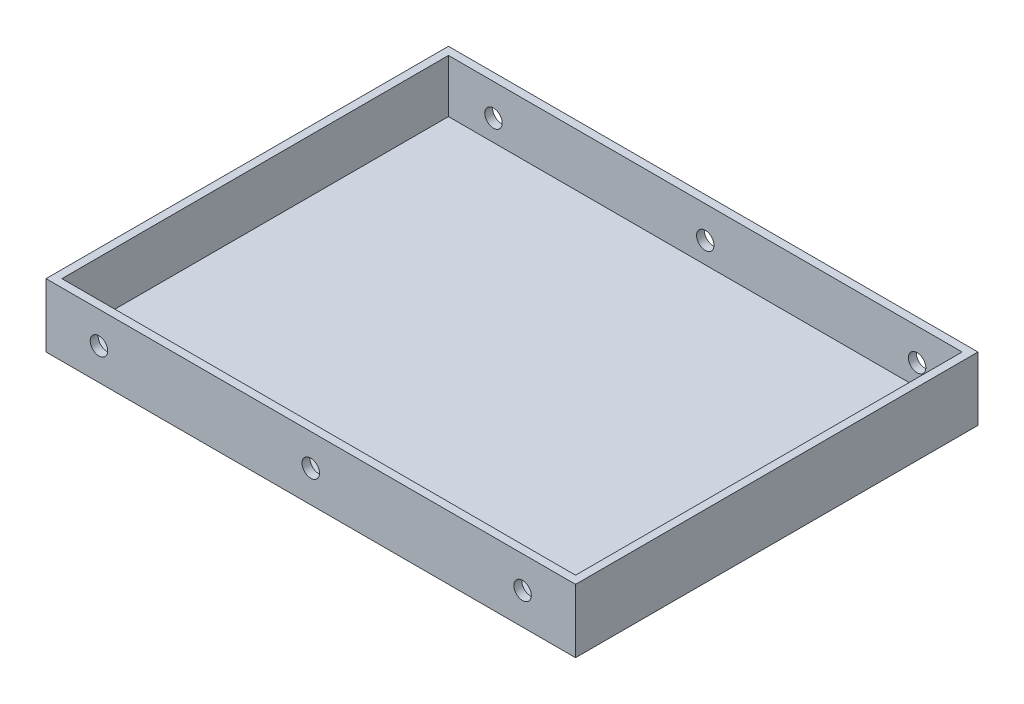
from build123d import *

# Parameters (mm, degrees)
SKETCH_1_W          = 100
SKETCH_1_H          = 76
EXTRUDE_1_DEPTH     = 12
SKETCH_2_W          = 97
SKETCH_2_H          = 73
CUT_EXTRUDE_1_DEPTH = 10
SKETCH_3_R          = 1.65
CUT_EXTRUDE_2_DEPTH = 127.174482365


with BuildPart() as part:
    # 草图1 → 凸台-拉伸1 (new body)
    with BuildSketch(Plane(origin=(0, 0, 0), x_dir=(1, 0, 0), z_dir=(0, 1, 0))):
        with Locations((50, 38)):
            Rectangle(SKETCH_1_W, SKETCH_1_H)
    extrude(amount=EXTRUDE_1_DEPTH)

    # 草图2 → 切除-拉伸1 (cut)
    with BuildSketch(Plane(origin=(0, 12, 0), x_dir=(1, 0, 0), z_dir=(0, 1, 0))):
        with Locations((50, 38)):
            Rectangle(SKETCH_2_W, SKETCH_2_H)
    extrude(amount=-CUT_EXTRUDE_1_DEPTH, mode=Mode.SUBTRACT)

    # 草图3 → 切除-拉伸2 (cut, through all)
    with BuildSketch(Plane(origin=(0, 0, -76), x_dir=(-1, 0, 0), z_dir=(0, 0, -1))):
        with Locations((-90, 6)):
            Circle(SKETCH_3_R)
        with Locations((-10, 6)):
            Circle(SKETCH_3_R)
        with Locations((-50, 6)):
            Circle(SKETCH_3_R)
    extrude(amount=-CUT_EXTRUDE_2_DEPTH, mode=Mode.SUBTRACT)


solid = part.part
